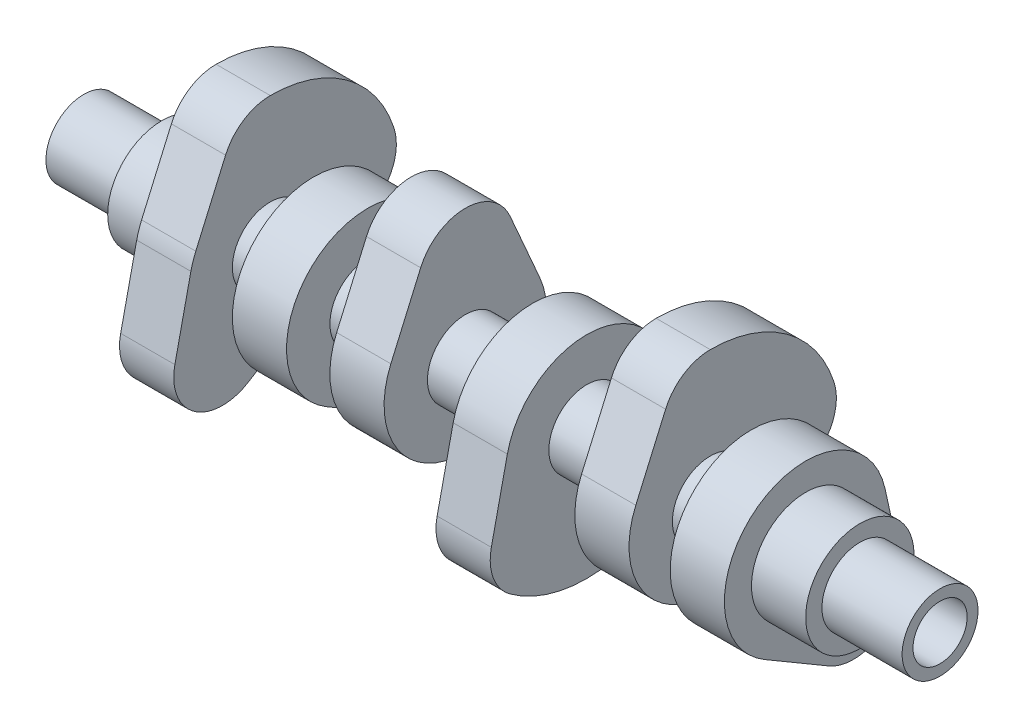
from build123d import *

# Parameters (mm, degrees)
BOSS_EXTRUDE1_DEPTH     = 6.35
BOSS_EXTRUDE2_START     = 5.08
BOSS_EXTRUDE2_DEPTH     = 6.35
BOSS_EXTRUDE3_START     = 5.08
BOSS_EXTRUDE3_DEPTH     = 6.35
BOSS_EXTRUDE4_START     = 7.874
BOSS_EXTRUDE4_DEPTH     = 6.35
BOSS_EXTRUDE5_START     = -1.778
BOSS_EXTRUDE5_DEPTH     = 6.35
BOSS_EXTRUDE6_START     = 4.826
BOSS_EXTRUDE6_DEPTH     = 6.35
BOSS_EXTRUDE7_START     = 1.016
SKETCH7_R               = 4.445
BOSS_EXTRUDE7_DEPTH     = 100.33
CUT_EXTRUDE1_DEPTH      = 103.55063169
CUT_EXTRUDE1_DEPTH_BACK = 103.55063169
SKETCH8_R               = 3.175
SKETCH9_R               = 6.35
BOSS_EXTRUDE8_DEPTH     = 6.35
SKETCH10_R              = 6.35
BOSS_EXTRUDE9_DEPTH     = 6.35


with BuildPart() as part:
    # Sketch1 → Boss-Extrude1 (new body)
    with BuildSketch(Plane(origin=(0, 0, 0), x_dir=(0, 0, -1), z_dir=(1, 0, 0))):
        with BuildLine():
            Line((-5.237884019, 11.811), (-8.729806699, 3.81))
            ThreePointArc((-8.729806699, 3.81), (-9.058813318, 2.943386871), (-9.302023788, 2.048896884))
            Line((-9.302023788, 2.048896884), (-11.179868801, -6.476548741))
            ThreePointArc((-11.179868801, -6.476548741), (-8.918189467, -12.3579738), (-2.620941048, -12.583842123))
            Line((-2.620941048, -12.583842123), (6.321183955, -7.125184798))
            Line((6.321183955, -7.125184798), (12.851523691, -1.331724008))
            ThreePointArc((12.851523691, -1.331724008), (14.573597143, 1.443925515), (14.494101308, 4.709418994))
            ThreePointArc((14.494101308, 4.709418994), (8.957847245, 12.329418994), (0, 15.24))
            ThreePointArc((0, 15.24), (-3.130234416, 14.306512052), (-5.237884019, 11.811))
        make_face()
    extrude(amount=BOSS_EXTRUDE1_DEPTH)


with BuildPart() as body_2:
    # Sketch2 → Boss-Extrude2 (new body)
    with BuildSketch(Plane(origin=(6.35, 0, 0), x_dir=(0, 0, -1), z_dir=(1, 0, 0)).offset(BOSS_EXTRUDE2_START)):
        with BuildLine():
            Line((11.179868801, -6.476548741), (9.302023788, 2.048896884))
            ThreePointArc((9.302023788, 2.048896884), (-5.598654528, 7.705886871), (-4.823100166, -8.213606382))
            Line((-4.823100166, -8.213606382), (2.704794429, -12.6340507))
            ThreePointArc((2.704794429, -12.6340507), (8.957847245, -12.329418994), (11.179868801, -6.476548741))
        make_face()
    extrude(amount=BOSS_EXTRUDE2_DEPTH)


with BuildPart() as body_3:
    # Sketch3 → Boss-Extrude3 (new body)
    with BuildSketch(Plane(origin=(17.78, 0, 0), x_dir=(0, 0, -1), z_dir=(1, 0, 0)).offset(BOSS_EXTRUDE3_START)):
        with BuildLine():
            Line((-5.237884019, 11.811), (-8.729806699, 3.81))
            ThreePointArc((-8.729806699, 3.81), (0, -9.525), (8.729806699, 3.81))
            Line((8.729806699, 3.81), (5.237884019, 11.811))
            ThreePointArc((5.237884019, 11.811), (0, 15.24), (-5.237884019, 11.811))
        make_face()
    extrude(amount=BOSS_EXTRUDE3_DEPTH)


with BuildPart() as body_4:
    # Sketch4 → Boss-Extrude4 (new body)
    with BuildSketch(Plane(origin=(29.21, 0, 0), x_dir=(0, 0, -1), z_dir=(1, 0, 0)).offset(BOSS_EXTRUDE4_START)):
        with BuildLine():
            Line((-11.179868801, -6.476548741), (-9.302023788, 2.048896884))
            ThreePointArc((-9.302023788, 2.048896884), (0, 9.525), (9.302023788, 2.048896884))
            Line((9.302023788, 2.048896884), (11.179868801, -6.476548741))
            ThreePointArc((11.179868801, -6.476548741), (10.941569635, -9.734305754), (8.957847245, -12.329418994))
            ThreePointArc((8.957847245, -12.329418994), (0, -15.24), (-8.957847245, -12.329418994))
            ThreePointArc((-8.957847245, -12.329418994), (-10.941569635, -9.734305754), (-11.179868801, -6.476548741))
        make_face()
    extrude(amount=BOSS_EXTRUDE4_DEPTH)


with BuildPart() as body_5:
    # Sketch5 → Boss-Extrude5 (new body)
    with BuildSketch(Plane(origin=(53.34, 0, 0), x_dir=(0, 0, -1), z_dir=(1, 0, 0)).offset(BOSS_EXTRUDE5_START)):
        with BuildLine():
            Line((-5.237884019, 11.811), (-8.729806699, 3.81))
            ThreePointArc((-8.729806699, 3.81), (-5.598654528, -7.705886871), (6.321183955, -7.125184798))
            Line((6.321183955, -7.125184798), (12.851523691, -1.331724008))
            ThreePointArc((12.851523691, -1.331724008), (14.573597143, 1.443925515), (14.494101308, 4.709418994))
            ThreePointArc((14.494101308, 4.709418994), (8.957847245, 12.329418994), (0, 15.24))
            ThreePointArc((0, 15.24), (-3.130234416, 14.306512052), (-5.237884019, 11.811))
        make_face()
    extrude(amount=BOSS_EXTRUDE5_DEPTH)


with BuildPart() as body_6:
    # Sketch6 → Boss-Extrude6 (new body)
    with BuildSketch(Plane(origin=(57.912, 0, 0), x_dir=(0, 0, -1), z_dir=(1, 0, 0)).offset(BOSS_EXTRUDE6_START)):
        with BuildLine():
            Line((11.179868801, -6.476548741), (9.302023788, 2.048896884))
            ThreePointArc((9.302023788, 2.048896884), (-5.598654528, 7.705886871), (-4.823100166, -8.213606382))
            Line((-4.823100166, -8.213606382), (2.704794429, -12.6340507))
            ThreePointArc((2.704794429, -12.6340507), (8.957847245, -12.329418994), (11.179868801, -6.476548741))
        make_face()
    extrude(amount=BOSS_EXTRUDE6_DEPTH)


with BuildPart() as body_7:
    # Sketch7 → Boss-Extrude7 (new body)
    with BuildSketch(Plane(origin=(83.82, 0, 0), x_dir=(0, 0, -1), z_dir=(1, 0, 0)).offset(BOSS_EXTRUDE7_START)):
        Circle(SKETCH7_R)
    extrude(amount=-BOSS_EXTRUDE7_DEPTH)


with BuildPart() as cut_extrude1_tool:
    # Sketch8 → Cut-Extrude1 (new, two sides: drawn at the far end of the back side and taken through both)
    with BuildSketch(Plane(origin=(84.836, 0, 0), x_dir=(0, 0, -1), z_dir=(1, 0, 0)).offset(-CUT_EXTRUDE1_DEPTH_BACK)):
        Circle(SKETCH8_R)
    extrude(amount=CUT_EXTRUDE1_DEPTH + CUT_EXTRUDE1_DEPTH_BACK)


with BuildPart() as part_1:
    add(part.part)

    # Cut-Extrude1: cut by cut_extrude1_tool
    add(cut_extrude1_tool.part, mode=Mode.SUBTRACT)



with BuildPart() as body_2_1:
    add(body_2.part)

    # Cut-Extrude1: cut by cut_extrude1_tool
    add(cut_extrude1_tool.part, mode=Mode.SUBTRACT)


with BuildPart() as body_3_1:
    add(body_3.part)

    # Cut-Extrude1: cut by cut_extrude1_tool
    add(cut_extrude1_tool.part, mode=Mode.SUBTRACT)


with BuildPart() as body_4_1:
    add(body_4.part)

    # Cut-Extrude1: cut by cut_extrude1_tool
    add(cut_extrude1_tool.part, mode=Mode.SUBTRACT)


with BuildPart() as body_5_1:
    add(body_5.part)

    # Cut-Extrude1: cut by cut_extrude1_tool
    add(cut_extrude1_tool.part, mode=Mode.SUBTRACT)


with BuildPart() as body_6_1:
    add(body_6.part)

    # Cut-Extrude1: cut by cut_extrude1_tool
    add(cut_extrude1_tool.part, mode=Mode.SUBTRACT)



with BuildPart() as body_7_1:
    add(body_7.part)

    # Cut-Extrude1: cut by cut_extrude1_tool
    add(cut_extrude1_tool.part, mode=Mode.SUBTRACT)


with BuildPart() as body_6_2:
    add(body_6_1.part)

    add(body_7_1.part)  # Boss-Extrude8 merges body 7
    # Sketch9 → Boss-Extrude8 (add)
    with BuildSketch(Plane(origin=(69.088, 0, 0), x_dir=(0, 0, -1), z_dir=(1, 0, 0))):
        Circle(SKETCH9_R)
    extrude(amount=BOSS_EXTRUDE8_DEPTH)


with BuildPart() as part_2:
    add(part_1.part)

    add(body_6_2.part)  # Boss-Extrude9 merges body 6
    # Sketch10 → Boss-Extrude9 (add)
    with BuildSketch(Plane.ZY):
        with Locations(Location((0, 0, 0), (0, 0, 180))):
            Circle(SKETCH10_R)
    extrude(amount=BOSS_EXTRUDE9_DEPTH)


solid = Compound([body_2_1.part, body_3_1.part, body_4_1.part, body_5_1.part, part_2.part])
